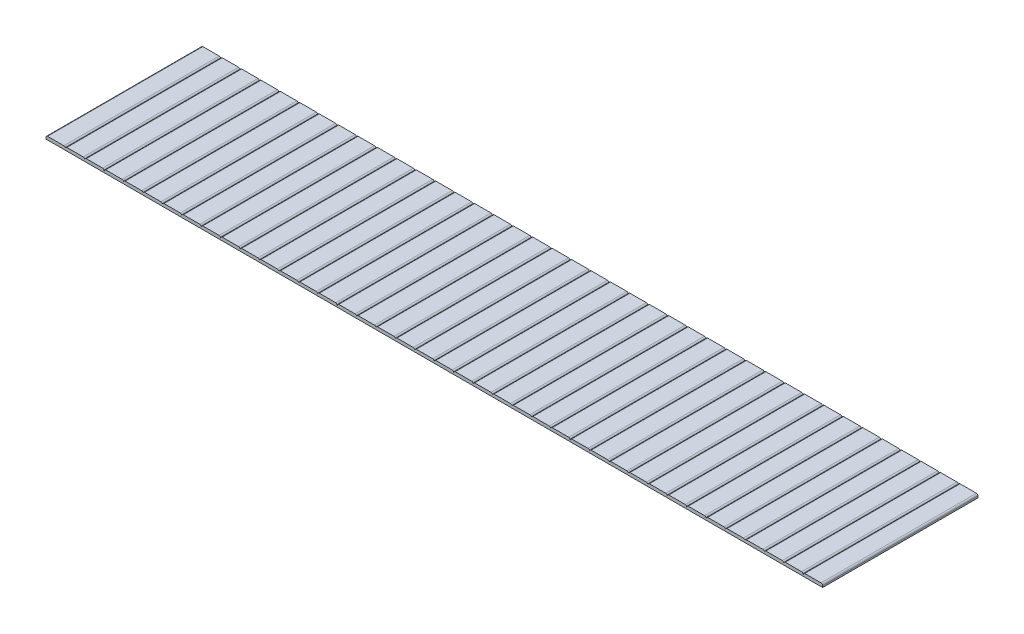
from build123d import *

# Parameters (mm, degrees)
BOSS_EXTRUDE1_DEPTH = 2438.4
LPATTERN1_COUNT     = 40
LPATTERN1_PITCH     = 304.8


with BuildPart() as part:
    # Sketch1 → Boss-Extrude1 (new body)
    with BuildSketch(Plane.XY):
        with BuildLine():
            Line((6096, 2895.6), (5791.2, 2895.6))
            Line((5791.2, 2895.6), (5791.2, 2921))
            ThreePointArc((5791.2, 2921), (5798.639487758, 2938.960512242), (5816.6, 2946.4))
            Line((5816.6, 2946.4), (6070.6, 2946.4))
            ThreePointArc((6070.6, 2946.4), (6088.560512242, 2938.960512242), (6096, 2921))
            Line((6096, 2921), (6096, 2895.6))
        make_face()
    boss_extrude1 = extrude(amount=-BOSS_EXTRUDE1_DEPTH)

    # LPattern1: Boss-Extrude1 ×40
    with Locations(*[(-i * LPATTERN1_PITCH, 0, 0) for i in range(1, LPATTERN1_COUNT)]):
        add(boss_extrude1)


solid = part.part
